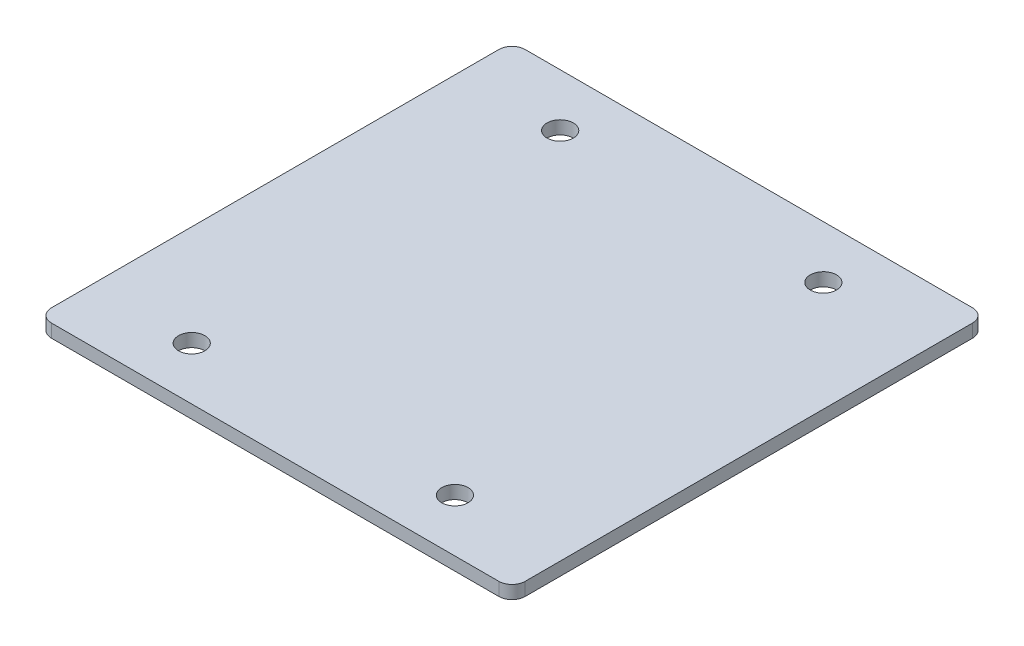
from build123d import *

# Parameters (mm, degrees)
SKETCH2_W           = 114.3
SKETCH2_H           = 114.3
BOSS_EXTRUDE1_DEPTH = 3.175
FILLET1_R           = 3.175
SKETCH3_R           = 3.175
CUT_EXTRUDE1_DEPTH  = 162.675788617


with BuildPart() as part:
    # Sketch2 → Boss-Extrude1 (new body)
    with BuildSketch(Plane(origin=(0, 0, 0), x_dir=(1, 0, 0), z_dir=(0, 1, 0))):
        with Locations((57.15, 57.15)):
            Rectangle(SKETCH2_W, SKETCH2_H)
    extrude(amount=BOSS_EXTRUDE1_DEPTH)

    # Fillet1
    fillet1_edges = [part.edges().sort_by_distance(p)[0] for p in [
        (0, 1.5875, -114.3),
        (114.3, 1.5875, -114.3),
        (114.3, 1.5875, 0),
        (0, 1.5875, 0),
    ]]
    fillet(fillet1_edges, radius=FILLET1_R)

    # Sketch3 → Cut-Extrude1 (cut, through all)
    with BuildSketch(Plane(origin=(0, 3.175, 0), x_dir=(1, 0, 0), z_dir=(0, 1, 0))):
        with Locations(Location((24.32291575, 101.6, 0), (0, 0, 270))):
            Circle(SKETCH3_R)
        with Locations(Location((24.32291575, 12.7, 0), (0, 0, 270))):
            Circle(SKETCH3_R)
        with Locations(Location((87.82291575, 12.7, 0), (0, 0, 270))):
            Circle(SKETCH3_R)
        with Locations(Location((87.82291575, 101.6, 0), (0, 0, 270))):
            Circle(SKETCH3_R)
    extrude(amount=-CUT_EXTRUDE1_DEPTH, mode=Mode.SUBTRACT)


solid = part.part
